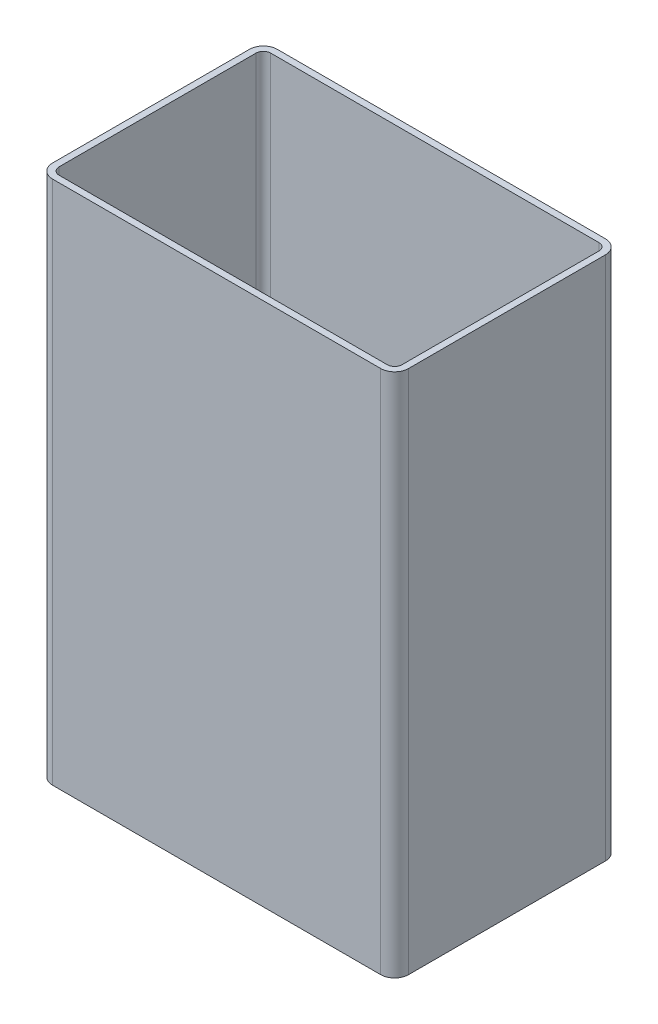
from build123d import *

# Parameters (mm, degrees)
BOSS_EXTRUDE1_DEPTH = 609.6
SHELL1_T            = -7.62


with BuildPart() as part:
    # Sketch1 → Boss-Extrude1 (new body)
    with BuildSketch(Plane(origin=(0, 0, 0), x_dir=(1, 0, 0), z_dir=(0, 1, 0))):
        with BuildLine():
            Line((0, 0), (381, 0))
            ThreePointArc((381, 0), (392.440846298, 4.738953702), (397.1798, 16.1798))
            Line((397.1798, 16.1798), (397.1798, 244.7798))
            ThreePointArc((397.1798, 244.7798), (392.440846298, 256.220646298), (381, 260.9596))
            Line((381, 260.9596), (0, 260.9596))
            ThreePointArc((0, 260.9596), (-11.440846298, 256.220646298), (-16.1798, 244.7798))
            Line((-16.1798, 244.7798), (-16.1798, 16.1798))
            ThreePointArc((-16.1798, 16.1798), (-11.440846298, 4.738953702), (0, 0))
        make_face()
    extrude(amount=-BOSS_EXTRUDE1_DEPTH)

    # Shell1
    shell1_openings = [part.faces().sort_by_distance(p)[0] for p in [
        (190.5, 0, -130.4798),
    ]]
    offset(amount=SHELL1_T, openings=shell1_openings, kind=Kind.INTERSECTION)


solid = part.part
